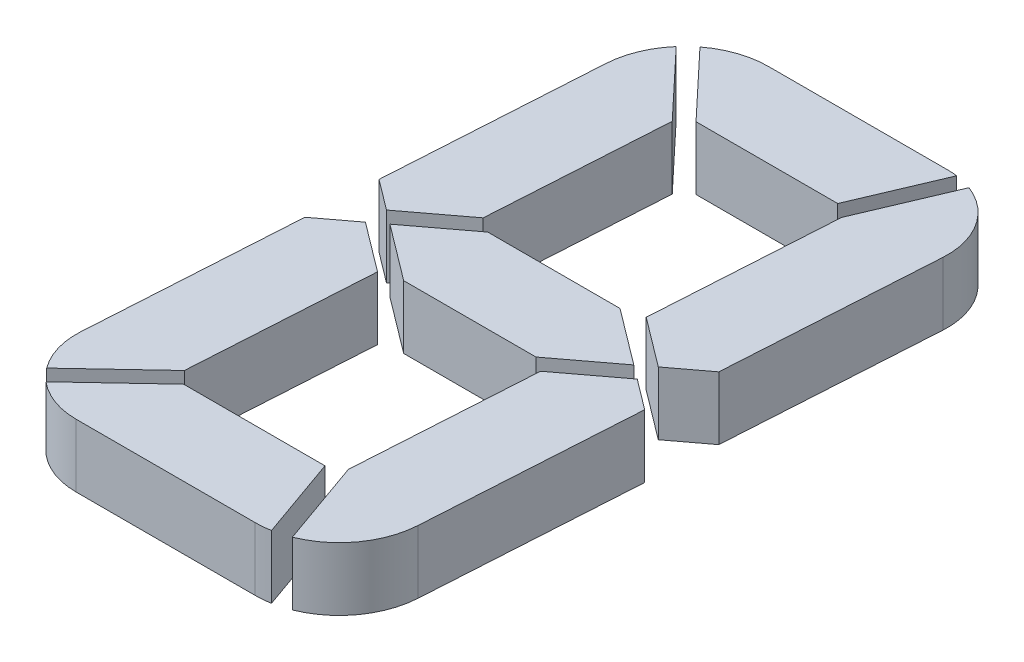
from build123d import *

# Parameters (mm, degrees)
BOSS_EXTRUDE1_DEPTH   = 6
BOSS_EXTRUDE1_2_DEPTH = 6
BOSS_EXTRUDE1_3_DEPTH = 6
BOSS_EXTRUDE1_4_DEPTH = 6
BOSS_EXTRUDE1_5_DEPTH = 6
BOSS_EXTRUDE1_6_DEPTH = 6
BOSS_EXTRUDE1_7_DEPTH = 6


with BuildPart() as part:
    # Sketch3 → Boss-Extrude1 (new body)
    with BuildSketch(Plane(origin=(0, 0, 0), x_dir=(1, 0, 0), z_dir=(0, 1, 0))):
        with BuildLine():
            ThreePointArc((-14.563388627, 23.488388316), (-13.982347964, 26.029888674), (-12.614994756, 28.249613324))
            Line((-12.614994756, 28.249613324), (-6.645362379, 21.903707215))
            Line((-6.645362379, 21.903707215), (-7.681935248, 4.955890615))
            Line((-7.681935248, 4.955890615), (-12.929312113, 1.001708527))
            Line((-12.929312113, 1.001708527), (-15.806141704, 3.169555117))
            Line((-15.806141704, 3.169555117), (-14.563388627, 23.488388316))
        make_face()
    extrude(amount=-BOSS_EXTRUDE1_DEPTH)


with BuildPart() as body_2:
    # Sketch3 → Boss-Extrude1 2 (new body)
    with BuildSketch(Plane(origin=(0, 0, 0), x_dir=(1, 0, 0), z_dir=(0, 1, 0))):
        with BuildLine():
            ThreePointArc((10.454822074, 31), (10.91413207, 30.984914769), (11.371462409, 30.939724094))
            Line((11.371462409, 30.939724094), (8.001249484, 23))
            Line((8.001249484, 23), (-5.479968827, 23))
            Line((-5.479968827, 23), (-11.449601204, 29.345906109))
            ThreePointArc((-11.449601204, 29.345906109), (-9.150541871, 30.57519798), (-6.57831024, 31))
            Line((-6.57831024, 31), (10.454822074, 31))
        make_face()
    extrude(amount=-BOSS_EXTRUDE1_2_DEPTH)


with BuildPart() as body_3:
    # Sketch3 → Boss-Extrude1 3 (new body)
    with BuildSketch(Plane(origin=(0, 0, 0), x_dir=(1, 0, 0), z_dir=(0, 1, 0))):
        with BuildLine():
            ThreePointArc((12.941431756, 30.543452628), (16.335726731, 27.796703889), (17.441765663, 23.572660223))
            Line((17.441765663, 23.572660223), (16.212591289, 3.475836847))
            Line((16.212591289, 3.475836847), (12.929312113, 1.001708527))
            Line((12.929312113, 1.001708527), (8.261456028, 4.519190384))
            Line((8.261456028, 4.519190384), (9.333267306, 22.043149873))
            Line((9.333267306, 22.043149873), (12.941431756, 30.543452628))
        make_face()
    extrude(amount=-BOSS_EXTRUDE1_3_DEPTH)


with BuildPart() as body_4:
    # Sketch3 → Boss-Extrude1 4 (new body)
    with BuildSketch(Plane(origin=(0, 0, 0), x_dir=(1, 0, 0), z_dir=(0, 1, 0))):
        Polygon((-6.291820714, -4), (-11.6, 0), (-6.291820714, 4), (6.291820714, 4), (11.6, 0), (6.291820714, -4), align=None)
    extrude(amount=-BOSS_EXTRUDE1_4_DEPTH)


with BuildPart() as body_5:
    # Sketch3 → Boss-Extrude1 5 (new body)
    with BuildSketch(Plane(origin=(0, 0, 0), x_dir=(1, 0, 0), z_dir=(0, 1, 0))):
        with BuildLine():
            ThreePointArc((-16.068158856, -28.182158554), (-17.163296944, -25.999091025), (-17.441765663, -23.572660223))
            Line((-17.441765663, -23.572660223), (-16.212591289, -3.475836847))
            Line((-16.212591289, -3.475836847), (-12.929312113, -1.001708527))
            Line((-12.929312113, -1.001708527), (-8.261456028, -4.519190384))
            Line((-8.261456028, -4.519190384), (-9.320512244, -21.834606448))
            Line((-9.320512244, -21.834606448), (-16.068158856, -28.182158554))
        make_face()
    extrude(amount=-BOSS_EXTRUDE1_5_DEPTH)


with BuildPart() as body_6:
    # Sketch3 → Boss-Extrude1 6 (new body)
    with BuildSketch(Plane(origin=(0, 0, 0), x_dir=(1, 0, 0), z_dir=(0, 1, 0))):
        with BuildLine():
            ThreePointArc((-10.454822074, -31), (-12.859726985, -30.573920624), (-14.971866072, -29.347552106))
            Line((-14.971866072, -29.347552106), (-8.224219459, -23))
            Line((-8.224219459, -23), (5.220423905, -23))
            Line((5.220423905, -23), (8.007780574, -30.871252414))
            ThreePointArc((8.007780574, -30.871252414), (7.295938517, -30.967748092), (6.57831024, -31))
            Line((6.57831024, -31), (-10.454822074, -31))
        make_face()
    extrude(amount=-BOSS_EXTRUDE1_6_DEPTH)


with BuildPart() as body_7:
    # Sketch3 → Boss-Extrude1 7 (new body)
    with BuildSketch(Plane(origin=(0, 0, 0), x_dir=(1, 0, 0), z_dir=(0, 1, 0))):
        with BuildLine():
            Line((6.62830762, -22.182550065), (9.548273172, -30.428278413))
            ThreePointArc((9.548273172, -30.428278413), (13.062425539, -27.685749543), (14.563388627, -23.488388316))
            Line((14.563388627, -23.488388316), (15.806141704, -3.169555117))
            Line((15.806141704, -3.169555117), (12.929312113, -1.001708527))
            Line((12.929312113, -1.001708527), (7.681935248, -4.955890615))
            Line((7.681935248, -4.955890615), (6.62830762, -22.182550065))
        make_face()
    extrude(amount=-BOSS_EXTRUDE1_7_DEPTH)


solid = Compound([part.part, body_2.part, body_3.part, body_4.part, body_5.part, body_6.part, body_7.part])
